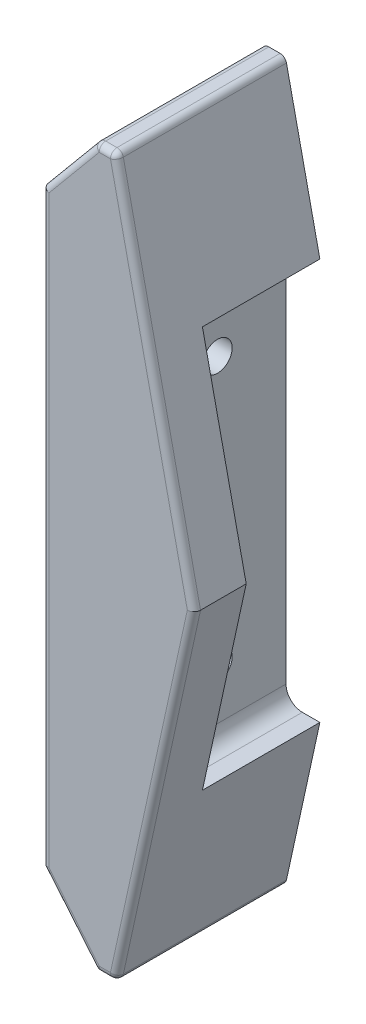
from build123d import *

# Parameters (mm, degrees)
MAIN_PROFILE_DEPTH                              = 26
SKETCH2_W                                       = 18
SKETCH2_H                                       = 61.5
BODY_ATTACHMENT_CAVITY_DEPTH                    = 11.9
FILLET1_R                                       = 2.5
SKETCH5_W                                       = 24
SKETCH5_H                                       = 82
FACE_CAVITY_DEPTH                               = 4
FILLET2_R                                       = 2.5
CUT_EXTRUDE3_DEPTH                              = 4
FILLET3_R                                       = 2.5
SKETCH8_W                                       = 27.49705506
SKETCH8_H                                       = 110
CUT_REVOLVE1_ANGLE                              = 4
M3X0_5_TAPPED_HOLE1_D                           = 2.5
M3X0_5_TAPPED_HOLE1_DEPTH                       = 10
M3X0_5_TAPPED_HOLE1_TIP                         = 0.751075774
CSK_FOR_M4_FLAT_HEAD_MACHINE_SCREW1_D           = 4.5
CSK_FOR_M4_FLAT_HEAD_MACHINE_SCREW1_DEPTH       = 10
CSK_FOR_M4_FLAT_HEAD_MACHINE_SCREW1_CSINK_D     = 9.4
CSK_FOR_M4_FLAT_HEAD_MACHINE_SCREW1_CSINK_ANGLE = 90
CSK_FOR_M4_FLAT_HEAD_MACHINE_SCREW1_TIP         = 1.351936393
F_3_32_0_09375_DIAMETER_HOLE1_D                 = 2.38125
F_3_32_0_09375_DIAMETER_HOLE1_DEPTH             = 5.284600325
F_3_32_0_09375_DIAMETER_HOLE1_TIP               = 0.715399675
FILLET4_R                                       = 1


with BuildPart() as part:
    # Sketch1 → Main Profile (new body)
    with BuildSketch(Plane.XY):
        Polygon((-2.5, 55), (-12.5, 43), (-12.5, -43), (-2.5, -55), (0.5, -55), (12.5, 0), (0.5, 55), align=None)
    extrude(amount=MAIN_PROFILE_DEPTH)

    # Sketch2 → Body Attachment Cavity (cut)
    with BuildSketch(Plane.ZY.offset(-12.5)):
        with Locations((9, 0)):
            Rectangle(SKETCH2_W, SKETCH2_H)
    extrude(amount=BODY_ATTACHMENT_CAVITY_DEPTH, mode=Mode.SUBTRACT)

    # Fillet1
    fillet1_edges = [part.edges().sort_by_distance(p)[0] for p in [
        (0.6, -30.75, 9),
        (0.6, 30.75, 9),
    ]]
    fillet(fillet1_edges, radius=FILLET1_R)

    # Sketch5 → Face Cavity (cut)
    with BuildSketch(Plane.ZY.offset(12.5)):
        with Locations((12, 0)):
            Rectangle(SKETCH5_W, SKETCH5_H)
    extrude(amount=-FACE_CAVITY_DEPTH, mode=Mode.SUBTRACT)

    # Fillet2
    fillet2_edges = [part.edges().sort_by_distance(p)[0] for p in [
        (-10.5, 41, 24),
        (-10.5, -41, 24),
    ]]
    fillet(fillet2_edges, radius=FILLET2_R)

    # Sketch7 → Cut-Extrude3 (cut)
    with BuildSketch(Plane(origin=(0, 0, 0), x_dir=(-1, 0, 0), z_dir=(0, 0, -1))):
        Polygon((10.5, 41), (1.077337627, 52.021045042), (1.077337627, -52.021045042), (10.5, -41), align=None)
    extrude(amount=-CUT_EXTRUDE3_DEPTH, mode=Mode.SUBTRACT)

    # Fillet3
    fillet3_edges = [part.edges().sort_by_distance(p)[0] for p in [
        (-1.077337627, -52.021045042, 2),
        (-1.077337627, 52.021045042, 2),
    ]]
    fillet(fillet3_edges, radius=FILLET3_R)

    # Sketch8 → Cut-Revolve1 (revolve, cut)
    with BuildSketch(Plane.ZY.offset(12.5)):
        with Locations((13.74852753, -6)):
            Rectangle(SKETCH8_W, SKETCH8_H)
    revolve(axis=Axis((-12.5, 49, 0), (0, 1, 0)), revolution_arc=CUT_REVOLVE1_ANGLE, mode=Mode.SUBTRACT)

    # M3x0.5 Tapped Hole1
    with Locations(Plane(origin=(0, 0, 4), x_dir=(-1, 0, 0), z_dir=(0, 0, -1))):
        with Locations((5.25, 40.95), (5.25, -40.95)):
            Hole(M3X0_5_TAPPED_HOLE1_D / 2, depth=M3X0_5_TAPPED_HOLE1_DEPTH)
            with Locations((0, 0, -(M3X0_5_TAPPED_HOLE1_DEPTH + M3X0_5_TAPPED_HOLE1_TIP / 2))):  # 118° drill point
                Cone(0, M3X0_5_TAPPED_HOLE1_D / 2, M3X0_5_TAPPED_HOLE1_TIP, mode=Mode.SUBTRACT)

    # CSK for M4 Flat Head Machine Screw1
    with Locations(Plane.ZY.offset(8.5)):
        with Locations((10.5, 20.5), (10.5, -20.5)):
            CounterSinkHole(CSK_FOR_M4_FLAT_HEAD_MACHINE_SCREW1_D / 2, CSK_FOR_M4_FLAT_HEAD_MACHINE_SCREW1_CSINK_D / 2, depth=CSK_FOR_M4_FLAT_HEAD_MACHINE_SCREW1_DEPTH, counter_sink_angle=CSK_FOR_M4_FLAT_HEAD_MACHINE_SCREW1_CSINK_ANGLE)
            with Locations((0, 0, -(CSK_FOR_M4_FLAT_HEAD_MACHINE_SCREW1_DEPTH + CSK_FOR_M4_FLAT_HEAD_MACHINE_SCREW1_TIP / 2))):  # 118° drill point
                Cone(0, CSK_FOR_M4_FLAT_HEAD_MACHINE_SCREW1_D / 2, CSK_FOR_M4_FLAT_HEAD_MACHINE_SCREW1_TIP, mode=Mode.SUBTRACT)

    # 3/32 (0.09375) Diameter Hole1
    with Locations(Plane(origin=(0, 0, 18), x_dir=(-1, 0, 0), z_dir=(0, 0, -1))):
        with Locations((-3.193818752, 28.18337425), (-3.193818752, -28.18337425)):
            Hole(F_3_32_0_09375_DIAMETER_HOLE1_D / 2, depth=F_3_32_0_09375_DIAMETER_HOLE1_DEPTH)
            with Locations((0, 0, -(F_3_32_0_09375_DIAMETER_HOLE1_DEPTH + F_3_32_0_09375_DIAMETER_HOLE1_TIP / 2))):  # 118° drill point
                Cone(0, F_3_32_0_09375_DIAMETER_HOLE1_D / 2, F_3_32_0_09375_DIAMETER_HOLE1_TIP, mode=Mode.SUBTRACT)

    # Fillet4
    fillet4_edges = [part.edges().sort_by_distance(p)[0] for p in [
        (-6.590951445, -50.090858266, 26),
        (-6.590951445, 50.090858266, 26),
        (-10.681902889, 0, 26),
        (-2.5, 55, 13),
        (0.5, 55, 13),
        (0.5, -55, 13),
        (-2.5, -55, 13),
        (-1, -55, 26),
        (6.5, -27.5, 26),
        (6.5, 27.5, 26),
        (-1, 55, 26),
    ]]
    fillet(fillet4_edges, radius=FILLET4_R)


solid = part.part
